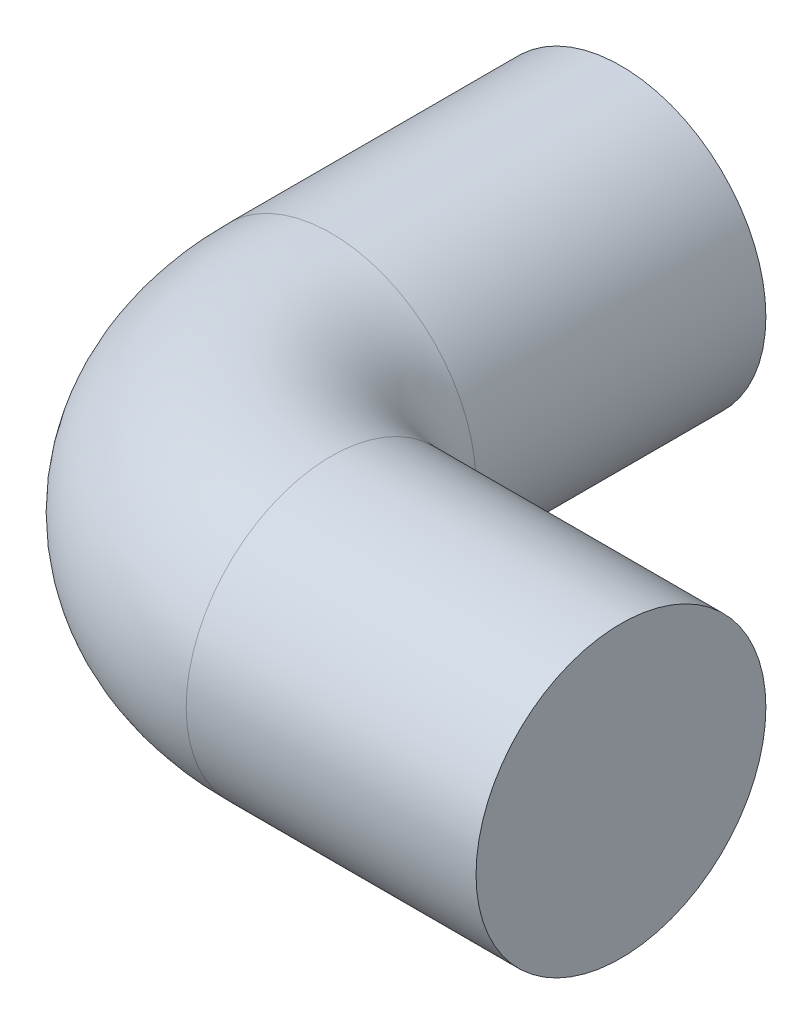
from build123d import *

# Parameters (mm, degrees)
SWEEP1_PROFILE_R = 37.5


with BuildPart() as part:
    # Sweep1: sweep along a path in Sketch1
    with BuildLine(Plane(origin=(0, 0, 0), x_dir=(1, 0, 0), z_dir=(0, 1, 0))) as sweep1_path:
        Line((0, 0), (-75, 0))
        ThreePointArc((-75, 0), (-110.355339059, 14.644660941), (-125, 50))
        Line((-125, 50), (-125, 125))
    # Sweep1 profile (on start of the path) → Sweep1 (sweep)
    with BuildSketch(Plane(origin=(0, 0, 0), x_dir=(0, 0, -1), z_dir=(-1, 0, 0))):
        Circle(SWEEP1_PROFILE_R)
    sweep(path=sweep1_path.line)


solid = part.part
